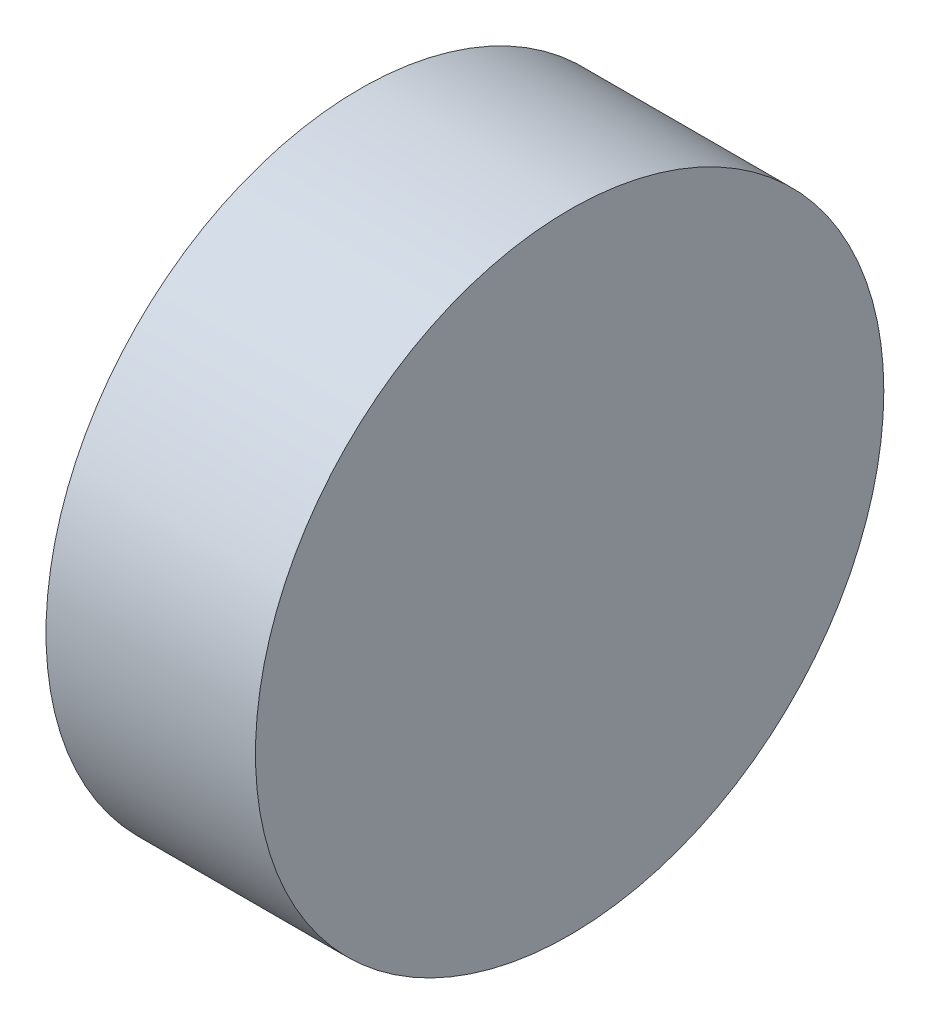
from build123d import *

# Parameters (mm, degrees)
SKETCH1_R           = 150
BOSS_EXTRUDE1_DEPTH = 100


with BuildPart() as part:
    # Sketch1 → Boss-Extrude1 (new body)
    with BuildSketch(Plane(origin=(0, 0, 0), x_dir=(0, 0, -1), z_dir=(1, 0, 0))):
        Circle(SKETCH1_R)
    extrude(amount=BOSS_EXTRUDE1_DEPTH)


solid = part.part
